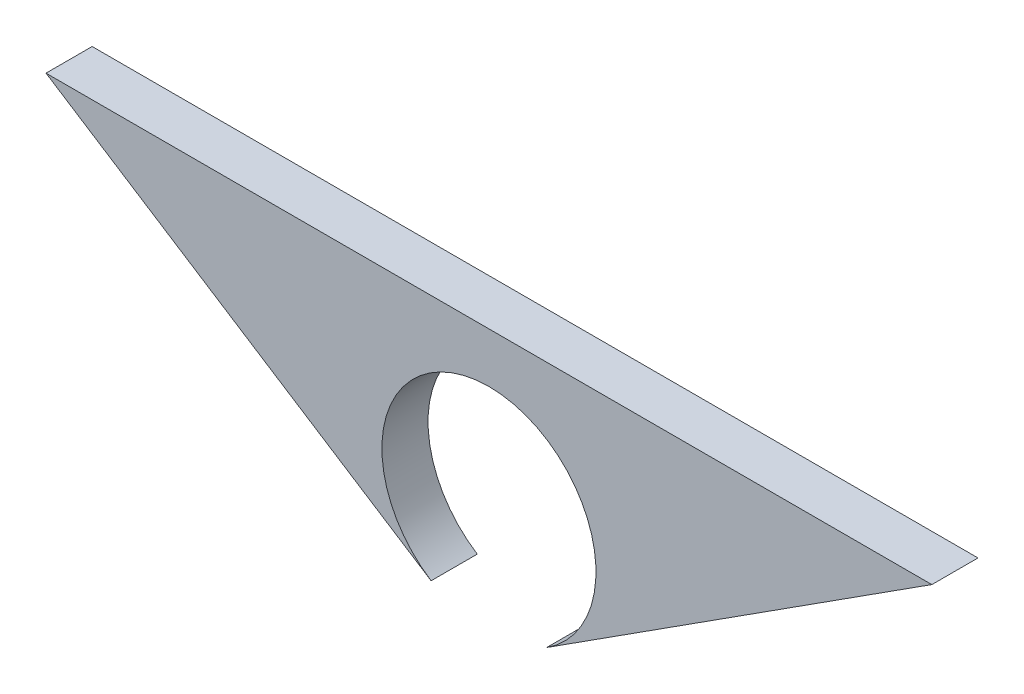
from build123d import *

# Parameters (mm, degrees)
BOSS_EXTRUDE1_DEPTH = 1.5875


with BuildPart() as part:
    # Sketch1 → Boss-Extrude1 (new body)
    with BuildSketch(Plane.XY):
        with BuildLine():
            Line((-15.24, 5.4), (15.24, 5.4))
            Line((15.24, 5.4), (1.988503193, -3.100055492))
            ThreePointArc((1.988503193, -3.100055492), (0, 3.683), (-1.988503193, -3.100055492))
            Line((-1.988503193, -3.100055492), (-15.24, 5.4))
        make_face()
    extrude(amount=BOSS_EXTRUDE1_DEPTH)


solid = part.part
